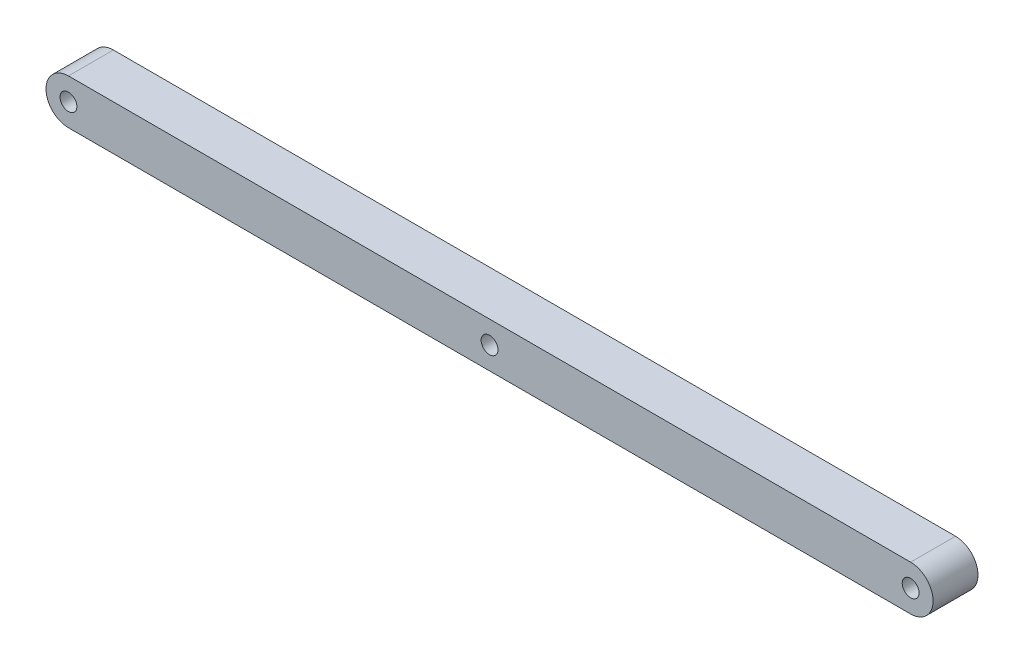
from build123d import *

# Parameters (mm, degrees)
SKETCH1_R           = 1.5
BOSS_EXTRUDE1_DEPTH = 8
SKETCH2_R           = 1.5
CUT_EXTRUDE1_DEPTH  = 10


with BuildPart() as part:
    # Sketch1 → Boss-Extrude1 (new body)
    with BuildSketch(Plane.XY):
        with BuildLine():
            Line((75, -4), (-75, -4))
            ThreePointArc((-75, -4), (-79, 0), (-75, 4))
            Line((-75, 4), (75, 4))
            ThreePointArc((75, 4), (79, 0), (75, -4))
        make_face()
        with Locations((-75, 0)):
            Circle(SKETCH1_R, mode=Mode.SUBTRACT)
        with Locations((75, 0)):
            Circle(SKETCH1_R, mode=Mode.SUBTRACT)
    extrude(amount=BOSS_EXTRUDE1_DEPTH)

    # Sketch2 → Cut-Extrude1 (cut)
    with BuildSketch(Plane.XY.offset(8)):
        Circle(SKETCH2_R)
    extrude(amount=-CUT_EXTRUDE1_DEPTH, mode=Mode.SUBTRACT)


solid = part.part
